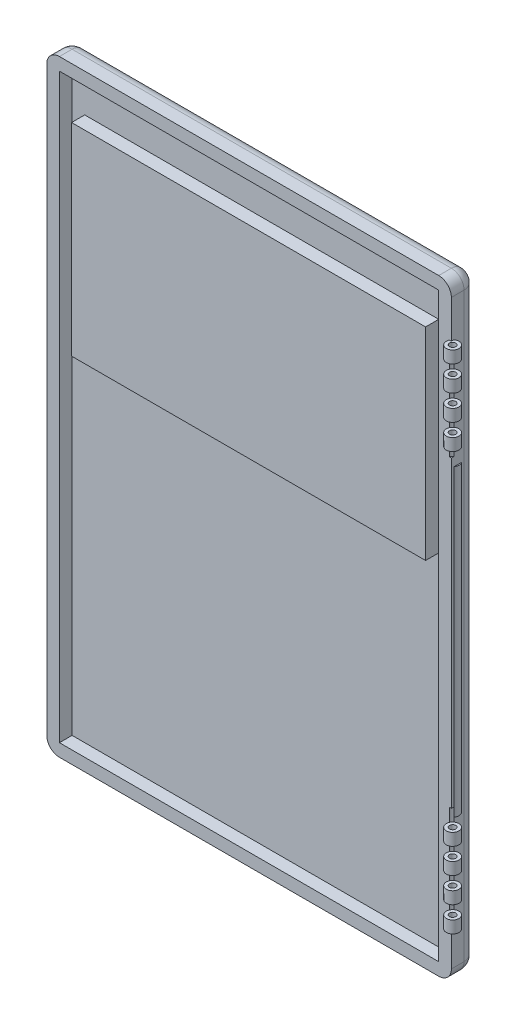
from build123d import *

# Parameters (mm, degrees)
SKETCH1_W                = 203.2
SKETCH1_H                = 304.8
BOSS_EXTRUDE1_DEPTH      = 12.7
FILLET1_R                = 6.35
SKETCH2_W                = 190.5
SKETCH2_H                = 292.1
CUT_EXTRUDE1_DEPTH       = 6.35
SKETCH3_R                = 3.175
BOSS_EXTRUDE3_DEPTH      = 127
SKETCH14_R               = 1.5875
CUT_EXTRUDE9_DEPTH       = 252.73
SKETCH6_W                = 3.175
SKETCH6_H                = 6.604
CUT_EXTRUDE14_DEPTH      = 187.551717494
CUT_EXTRUDE14_DEPTH_BACK = 187.551717494
SKETCH21_W               = 4.445
SKETCH21_H               = 152.4
CUT_EXTRUDE15_DEPTH      = 187.460913867
CUT_EXTRUDE15_DEPTH_BACK = 187.460913867
SKETCH22_W               = 3.81
SKETCH22_H               = 152.4
SKETCH24_W               = 177.8
SKETCH24_H               = 101.6
BOSS_EXTRUDE5_DEPTH      = 6.604


with BuildPart() as part:
    # Sketch1 → Boss-Extrude1 (new body)
    with BuildSketch(Plane.XY):
        Rectangle(SKETCH1_W, SKETCH1_H)
    extrude(amount=-BOSS_EXTRUDE1_DEPTH)

    # Fillet1
    fillet1_edges = [part.edges().sort_by_distance(p)[0] for p in [
        (101.6, 0, -12.7),
        (0, 152.4, -12.7),
        (-101.6, 0, -12.7),
        (-101.6, 152.4, -6.35),
        (101.6, 152.4, -6.35),
        (101.6, -152.4, -6.35),
        (-101.6, -152.4, -6.35),
        (0, -152.4, -12.7),
    ]]
    fillet(fillet1_edges, radius=FILLET1_R)

    # Sketch2 → Cut-Extrude1 (cut)
    with BuildSketch(Plane.XY):
        Rectangle(SKETCH2_W, SKETCH2_H)
    extrude(amount=-CUT_EXTRUDE1_DEPTH, mode=Mode.SUBTRACT)

    # Sketch3 → Boss-Extrude3 (add, symmetric)
    with BuildSketch(Plane(origin=(0, 0, 0), x_dir=(1, 0, 0), z_dir=(0, 1, 0))):
        with Locations((103.505, -1.27)):
            Circle(SKETCH3_R)
    extrude(amount=BOSS_EXTRUDE3_DEPTH, both=True)

    # Sketch14 → Cut-Extrude9 (cut)
    with BuildSketch(Plane(origin=(0, 127, 0), x_dir=(1, 0, 0), z_dir=(0, 1, 0))):
        with Locations(Location((103.505, -1.27, 0), (0, 0, 270))):
            Circle(SKETCH14_R)
    extrude(amount=-CUT_EXTRUDE9_DEPTH, mode=Mode.SUBTRACT)

    # Sketch6 → Cut-Revolve1 (revolve, cut)
    with BuildSketch(Plane.XY.offset(1.27), mode=Mode.PRIVATE) as cut_revolve1_sk:
        with Locations((105.0925, 117.602)):
            Rectangle(SKETCH6_W, SKETCH6_H)
        with Locations((105.0925, -92.202)):
            Rectangle(SKETCH6_W, SKETCH6_H)
        with Locations((105.0925, 104.902)):
            Rectangle(SKETCH6_W, SKETCH6_H)
        with Locations((105.0925, 92.202)):
            Rectangle(SKETCH6_W, SKETCH6_H)
        with Locations((105.0925, -117.602)):
            Rectangle(SKETCH6_W, SKETCH6_H)
        with Locations((105.0925, -104.902)):
            Rectangle(SKETCH6_W, SKETCH6_H)
        with Locations((105.0925, -79.502)):
            Rectangle(SKETCH6_W, SKETCH6_H)
        with Locations((105.0925, 79.502)):
            Rectangle(SKETCH6_W, SKETCH6_H)
    revolve(cut_revolve1_sk.sketch.rotate(Axis((103.505, 132.703354679, 1.27), (0, -1, 0)), 90), axis=Axis((103.505, 132.703354679, 1.27), (0, -1, 0)), mode=Mode.SUBTRACT)

    # Sketch21 → Cut-Extrude14 (cut, two sides: drawn at the far end of the back side and taken through both)
    with BuildSketch(Plane.XY.offset(1.27).offset(-CUT_EXTRUDE14_DEPTH_BACK)):
        with Locations((103.8225, 0)):
            Rectangle(SKETCH21_W, SKETCH21_H)
    extrude(amount=CUT_EXTRUDE14_DEPTH + CUT_EXTRUDE14_DEPTH_BACK, mode=Mode.SUBTRACT)


with BuildPart() as cut_extrude14_piece_1:
    # of the separate pieces the step leaves, piece 1, a body of its own (cut_extrude14_pieces)
    add(part.part.solids().sort_by_distance((95.25, -152.4, 0))[0])

    # Sketch22 → Cut-Extrude15 (cut, two sides: drawn at the far end of the back side and taken through both)
    with BuildSketch(Plane(origin=(0, 0, 0), x_dir=(0, 0, -1), z_dir=(1, 0, 0)).offset(-CUT_EXTRUDE15_DEPTH_BACK)):
        with Locations((-1.905, 0)):
            Rectangle(SKETCH22_W, SKETCH22_H)
    extrude(amount=CUT_EXTRUDE15_DEPTH + CUT_EXTRUDE15_DEPTH_BACK, mode=Mode.SUBTRACT)

    # Sketch24 → Boss-Extrude5 (add, symmetric)
    with BuildSketch(Plane.XY.offset(-6.35)):
        with Locations((0, 76.2)):
            Rectangle(SKETCH24_W, SKETCH24_H)
    extrude(amount=BOSS_EXTRUDE5_DEPTH, both=True)


with BuildPart() as cut_extrude14_piece_2:
    # of the separate pieces the step leaves, piece 2, a body of its own (cut_extrude14_pieces)
    add(part.part.solids().sort_by_distance((106.045, -76.2, 3.175))[0])


solid = Compound([cut_extrude14_piece_1.part, cut_extrude14_piece_2.part])
